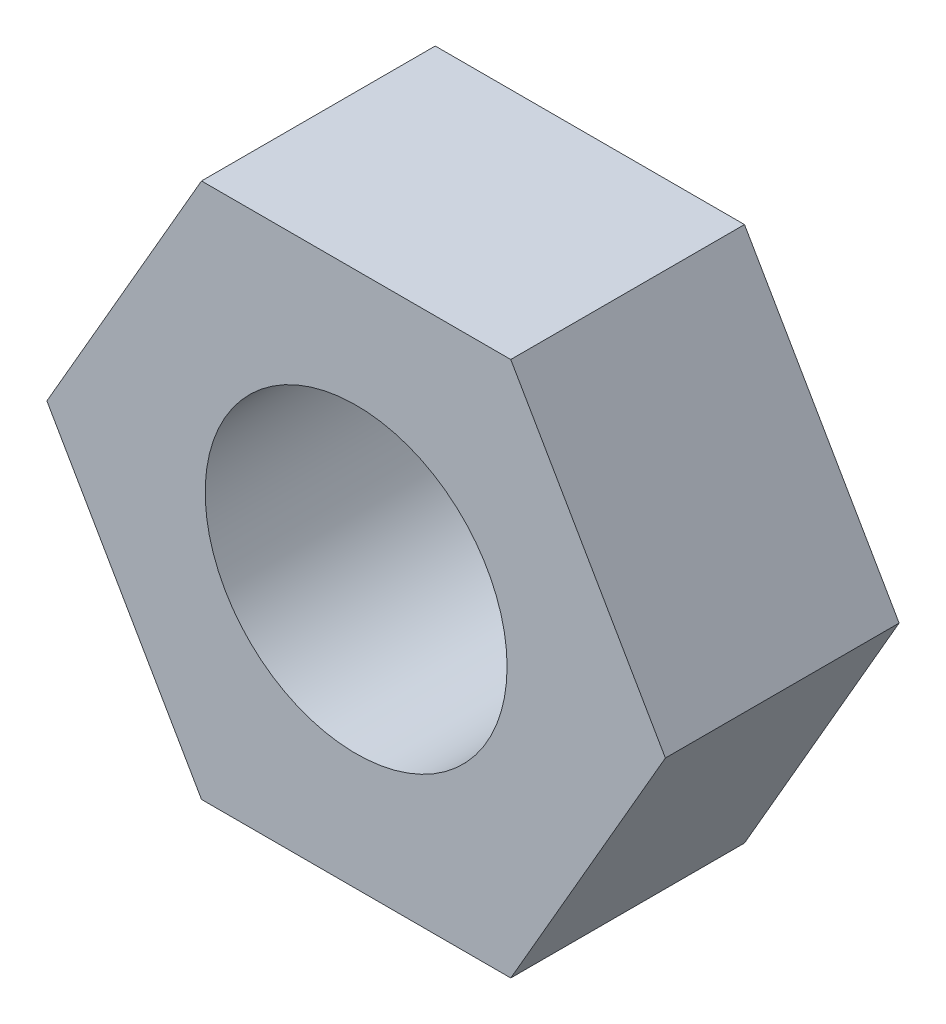
from build123d import *

# Parameters (mm, degrees)
SKETCH_1_R      = 1.55
EXTRUDE_1_DEPTH = 2.4


with BuildPart() as part:
    # 草图1 → 凸台-拉伸1 (new body)
    with BuildSketch(Plane.XY):
        Polygon((3.175426481, 0), (1.58771324, 2.75), (-1.58771324, 2.75), (-3.175426481, 0), (-1.58771324, -2.75), (1.58771324, -2.75), align=None)
        Circle(SKETCH_1_R, mode=Mode.SUBTRACT)
    extrude(amount=EXTRUDE_1_DEPTH)


solid = part.part
